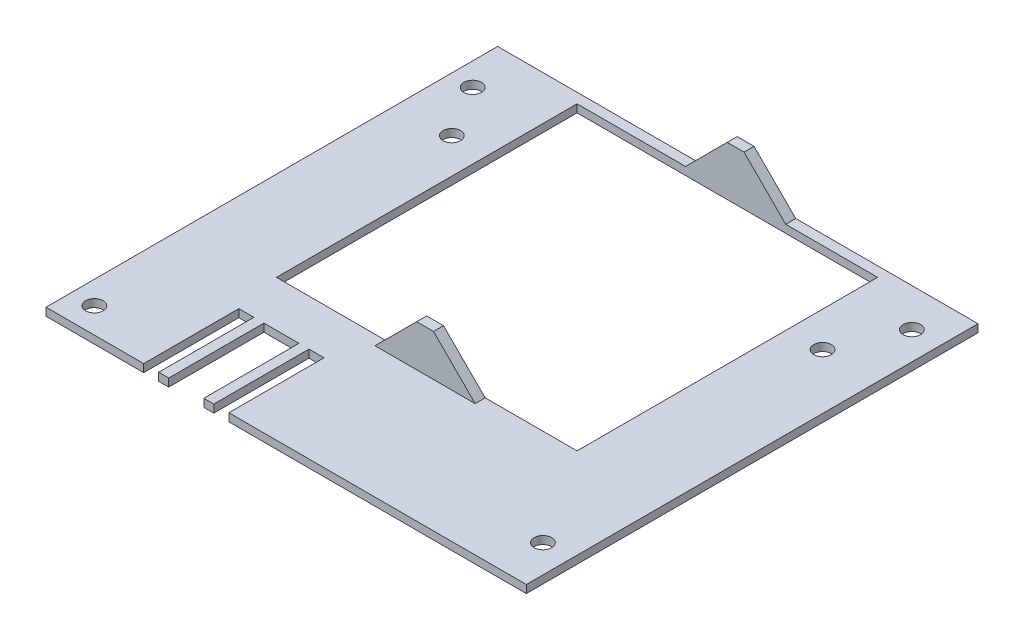
from build123d import *

# Parameters (mm, degrees)
SKETCH1_W               = 96.89
SKETCH1_H               = 90.17
PCB_DEPTH               = 1.57
SKETCH2_R               = 1.75
M3_MOUNTING_HOLES_DEPTH = 1.57
SKETCH4_R               = 1.75
CUT_EXTRUDE1_DEPTH      = 23
BOSS_EXTRUDE2_DEPTH     = 2
BOSS_EXTRUDE3_DEPTH     = 2
SKETCH9_W               = 3
SKETCH9_H               = 19
SKETCH9_W_2             = 7
CUT_EXTRUDE2_DEPTH      = 127.760011393
SKETCH10_W              = 0.5
SKETCH10_H              = 90.17
CUT_EXTRUDE3_DEPTH      = 10
SKETCH11_W              = 60
SKETCH11_H              = 60
CUT_EXTRUDE4_DEPTH      = 10


with BuildPart() as part:
    # Sketch1 → PCB (new body)
    with BuildSketch(Plane(origin=(0, 0, 0), x_dir=(1, 0, 0), z_dir=(0, 1, 0))):
        with Locations((16.200949951, 63.633996534)):
            Rectangle(SKETCH1_W, SKETCH1_H)
    extrude(amount=PCB_DEPTH)

    # Sketch2 → M3 Mounting Holes (cut)
    with BuildSketch(Plane(origin=(0, 1.57, 0), x_dir=(1, 0, 0), z_dir=(0, 1, 0))):
        with Locations(Location((58.565949951, 27.438996534, 0), (0, 0, 270))):
            Circle(SKETCH2_R)
        with Locations(Location((-27.164050049, 23.628996534, 0), (0, 0, 270))):
            Circle(SKETCH2_R)
        with Locations(Location((-27.164050049, 99.138996534, 0), (0, 0, 270))):
            Circle(SKETCH2_R)
        with Locations(Location((58.565949951, 101.098996534, 0), (0, 0, 270))):
            Circle(SKETCH2_R)
    extrude(amount=-M3_MOUNTING_HOLES_DEPTH, mode=Mode.SUBTRACT)

    # Sketch4 → Cut-Extrude1 (cut)
    with BuildSketch(Plane(origin=(0, 1.57, 0), x_dir=(1, 0, 0), z_dir=(0, 1, 0))):
        with Locations(Location((-20.894050049, 88.718996534, 0), (0, 0, 270))):
            Circle(SKETCH4_R)
        with Locations(Location((53.105949951, 88.718996534, 0), (0, 0, 270))):
            Circle(SKETCH4_R)
    extrude(amount=-CUT_EXTRUDE1_DEPTH, mode=Mode.SUBTRACT)

    # Sketch7 → Boss-Extrude2 (add)
    with BuildSketch(Plane.XY.offset(-46.718996534)):
        Polygon((27.755949951, 1.57), (19.438412086, 9.887537865), (16.073487816, 9.887537865), (7.755949951, 1.57), align=None)
    extrude(amount=BOSS_EXTRUDE2_DEPTH)

    # Sketch8 → Boss-Extrude3 (add)
    with BuildSketch(Plane.XY.offset(-108.718996534)):
        Polygon((27.755949951, 1.57), (19.438412086, 9.887537865), (16.073487816, 9.887537865), (7.755949951, 1.57), align=None)
    extrude(amount=BOSS_EXTRUDE3_DEPTH)

    # Sketch9 → Cut-Extrude2 (cut, through all)
    with BuildSketch(Plane(origin=(0, 1.57, 0), x_dir=(1, 0, 0), z_dir=(0, 1, 0))):
        with Locations((-10.744050049, 28.048996534)):
            Rectangle(SKETCH9_W, SKETCH9_H)
        with Locations((-3.744050049, 28.048996534)):
            Rectangle(SKETCH9_W_2, SKETCH9_H)
        with Locations((3.255949951, 28.048996534)):
            Rectangle(SKETCH9_W, SKETCH9_H)
    extrude(amount=-CUT_EXTRUDE2_DEPTH, mode=Mode.SUBTRACT)

    # Sketch10 → Cut-Extrude3 (cut)
    with BuildSketch(Plane(origin=(0, 1.57, 0), x_dir=(1, 0, 0), z_dir=(0, 1, 0))):
        with Locations((-31.994050049, 63.633996534)):
            Rectangle(SKETCH10_W, SKETCH10_H)
        with Locations((64.395949951, 63.633996534)):
            Rectangle(SKETCH10_W, SKETCH10_H)
    extrude(amount=-CUT_EXTRUDE3_DEPTH, mode=Mode.SUBTRACT)

    # Sketch11 → Cut-Extrude4 (cut)
    with BuildSketch(Plane(origin=(0, 1.57, 0), x_dir=(1, 0, 0), z_dir=(0, 1, 0))):
        with Locations((16.105949951, 76.718996534)):
            Rectangle(SKETCH11_W, SKETCH11_H)
    extrude(amount=-CUT_EXTRUDE4_DEPTH, mode=Mode.SUBTRACT)


solid = part.part
